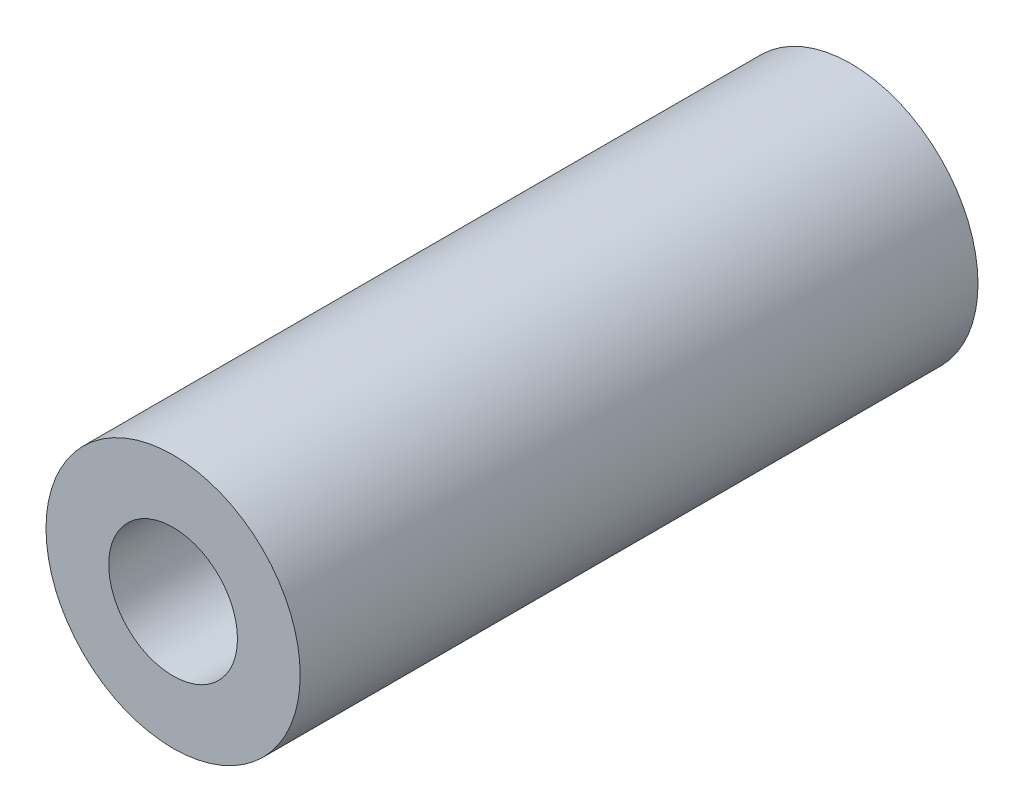
from build123d import *

# Parameters (mm, degrees)
SKETCH2_R           = 9.525
SKETCH2_R_2         = 4.826
BOSS_EXTRUDE1_DEPTH = 50.8


with BuildPart() as part:
    # Sketch2 → Boss-Extrude1 (new body)
    with BuildSketch(Plane.XY):
        Circle(SKETCH2_R)
        Circle(SKETCH2_R_2, mode=Mode.SUBTRACT)
    extrude(amount=BOSS_EXTRUDE1_DEPTH)


solid = part.part
